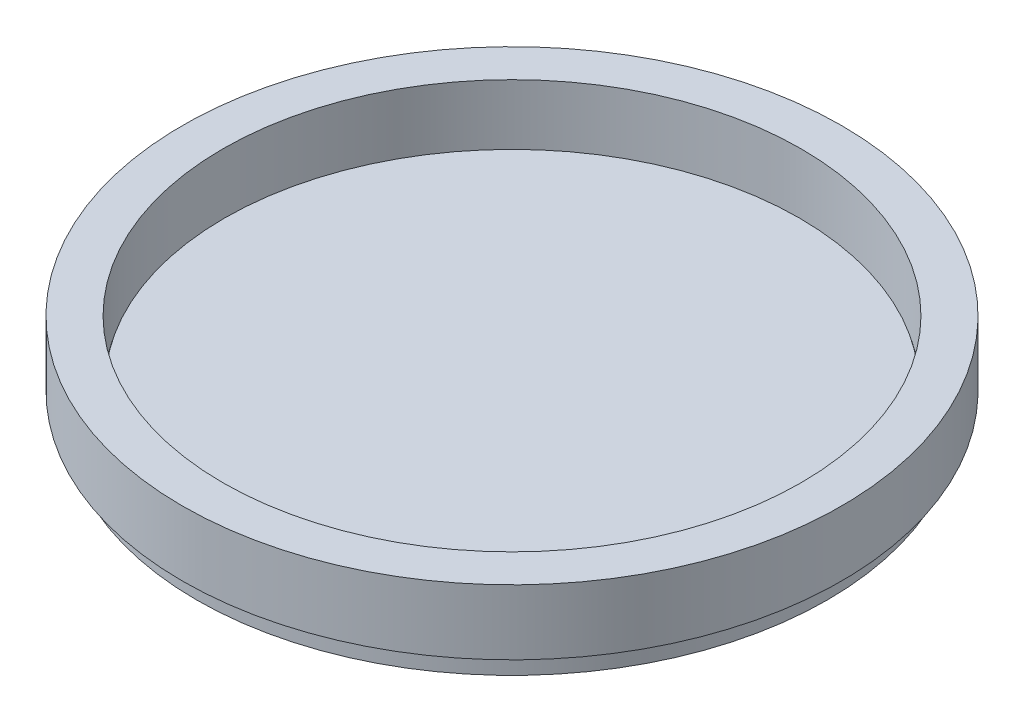
from build123d import *

# Parameters (mm, degrees)
SKETCH_1_R      = 28.65
SKETCH_1_R_2    = 25.14
EXTRUDE_1_DEPTH = 5.65
SKETCH_2_R      = 27.42
SKETCH_2_R_2    = 24.94
EXTRUDE_2_DEPTH = 2.04
SKETCH_3_R      = 25
EXTRUDE_3_DEPTH = 0.5


with BuildPart() as part:
    # Эскиз1 → Бобышка-Вытянуть1 (new body)
    with BuildSketch(Plane(origin=(0, 0, 0), x_dir=(1, 0, 0), z_dir=(0, 1, 0))):
        with Locations(Location((0, 0, 0), (0, 0, 270))):
            Circle(SKETCH_1_R)
        with Locations(Location((0, 0, 0), (0, 0, 270))):
            Circle(SKETCH_1_R_2, mode=Mode.SUBTRACT)
    extrude(amount=EXTRUDE_1_DEPTH)

    # Эскиз2 → Бобышка-Вытянуть2 (add)
    with BuildSketch(Plane.XZ):
        with Locations(Location((0, 0, 0), (0, 0, 270))):
            Circle(SKETCH_2_R)
        with Locations(Location((0, 0, 0), (0, 0, 270))):
            Circle(SKETCH_2_R_2, mode=Mode.SUBTRACT)
    extrude(amount=EXTRUDE_2_DEPTH)

    # Эскиз3 → Бобышка-Вытянуть3 (add, symmetric)
    with BuildSketch(Plane(origin=(0, 0, 0), x_dir=(1, 0, 0), z_dir=(0, 1, 0))):
        with Locations(Location((0, 0, 0), (0, 0, 90))):
            Circle(SKETCH_3_R)
    extrude(amount=EXTRUDE_3_DEPTH, both=True)


solid = part.part
